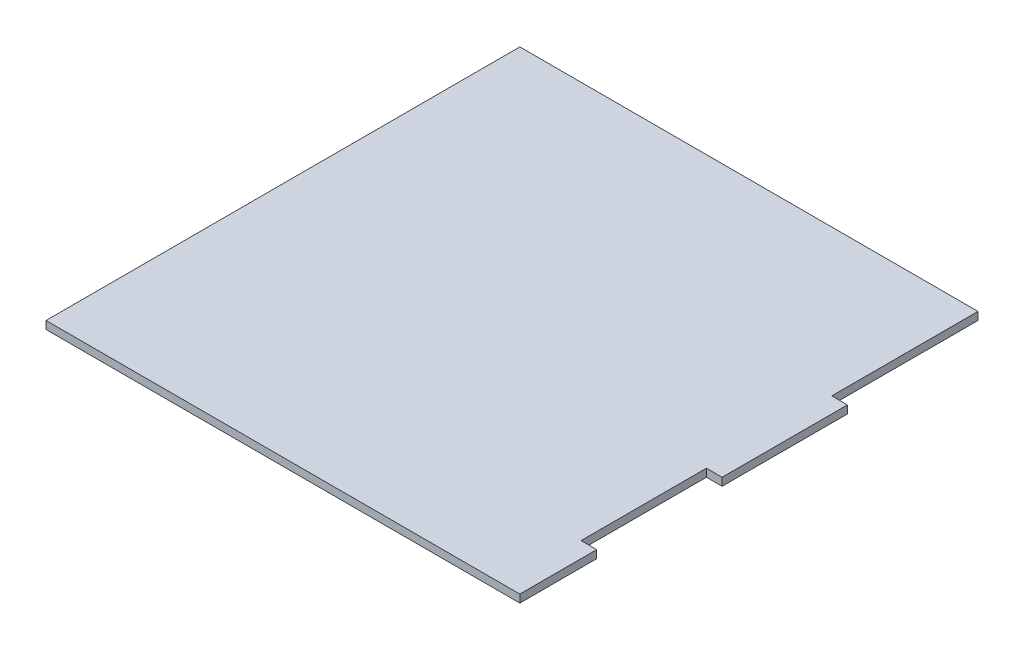
from build123d import *

# Parameters (mm, degrees)
BOSS_EXTRUDE1_DEPTH = 3.175


with BuildPart() as part:
    # Sketch1 → Boss-Extrude1 (new body)
    with BuildSketch(Plane(origin=(0, 0, 0), x_dir=(1, 0, 0), z_dir=(0, 1, 0))):
        Polygon((0, 0), (192, 0), (192, 31.159972621), (185.65, 31.159972621), (185.65, 81.959972621), (192, 81.959972621), (192, 132.759972621), (185.65, 132.759972621), (185.65, 192), (0, 192), align=None)
    extrude(amount=BOSS_EXTRUDE1_DEPTH)


solid = part.part
